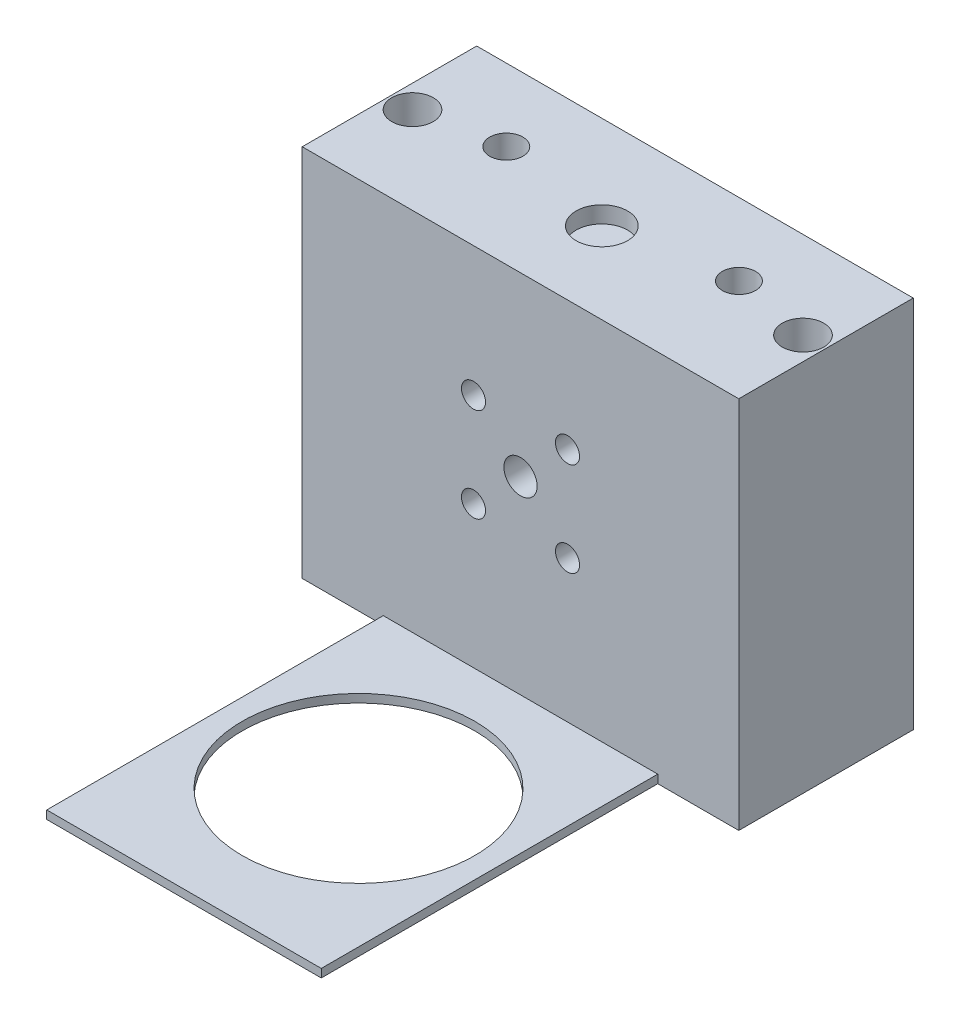
from build123d import *

# Parameters (mm, degrees)
SKETCH1_W                                            = 52.54
SKETCH1_H                                            = 21
SKETCH1_R                                            = 2.5
BOSS_EXTRUDE1_DEPTH                                  = 45
SKETCH2_R                                            = 2
CUT_EXTRUDE1_DEPTH                                   = 57.179292448
SKETCH3_R                                            = 2
CUT_EXTRUDE2_DEPTH                                   = 5
CBORE_FOR_M2_5_HEX_SOCKET_HEAD_CAP_SCREW_D           = 2.9
CBORE_FOR_M2_5_HEX_SOCKET_HEAD_CAP_SCREW_CBORE_D     = 5.5
CBORE_FOR_M2_5_HEX_SOCKET_HEAD_CAP_SCREW_CBORE_DEPTH = 16
SKETCH6_R                                            = 3.1
CUT_EXTRUDE3_DEPTH                                   = 2
SKETCH7_W                                            = 33.04
SKETCH7_H                                            = 40.5
SKETCH7_R                                            = 14
BOSS_EXTRUDE2_DEPTH                                  = 1


with BuildPart() as part:
    # Sketch1 → Boss-Extrude1 (new body)
    with BuildSketch(Plane(origin=(0, 0, 0), x_dir=(1, 0, 0), z_dir=(0, 1, 0))):
        Rectangle(SKETCH1_W, SKETCH1_H)
        with Locations(Location((23.5, 0, 0), (0, 0, 90))):
            Circle(SKETCH1_R, mode=Mode.SUBTRACT)
        with Locations(Location((-23.5, 0, 0), (0, 0, 90))):
            Circle(SKETCH1_R, mode=Mode.SUBTRACT)
    extrude(amount=BOSS_EXTRUDE1_DEPTH)

    # Sketch2 → Cut-Extrude1 (cut, through all)
    with BuildSketch(Plane(origin=(0, 0, -10.5), x_dir=(-1, 0, 0), z_dir=(0, 0, -1))):
        with Locations((0, 23.75)):
            Circle(SKETCH2_R)
    extrude(amount=-CUT_EXTRUDE1_DEPTH, mode=Mode.SUBTRACT)

    # Sketch3 → Cut-Extrude2 (cut)
    with BuildSketch(Plane(origin=(0, 45, 0), x_dir=(1, 0, 0), z_dir=(0, 1, 0))):
        with Locations(Location((-14, 1.79, 0), (0, 0, 270))):
            Circle(SKETCH3_R)
        with Locations(Location((14, 1.79, 0), (0, 0, 270))):
            Circle(SKETCH3_R)
    extrude(amount=-CUT_EXTRUDE2_DEPTH, mode=Mode.SUBTRACT)

    # CBORE for M2.5 Hex Socket Head Cap Screw1 (through all)
    with Locations(Plane(origin=(-5.656854249, 18.093145751, -10.5), x_dir=(-1, 0, 0), z_dir=(0, 0, -1))):
        with Locations((0, 0), (-11.313708498, 0), (-11.313708498, 11.313708498), (0, 11.313708498)):
            CounterBoreHole(CBORE_FOR_M2_5_HEX_SOCKET_HEAD_CAP_SCREW_D / 2, CBORE_FOR_M2_5_HEX_SOCKET_HEAD_CAP_SCREW_CBORE_D / 2, CBORE_FOR_M2_5_HEX_SOCKET_HEAD_CAP_SCREW_CBORE_DEPTH)

    # Sketch6 → Cut-Extrude3 (cut)
    with BuildSketch(Plane(origin=(0, 45, 0), x_dir=(1, 0, 0), z_dir=(0, 1, 0))):
        with Locations(Location((0, -0.71, 0), (0, 0, 270))):
            Circle(SKETCH6_R)
    extrude(amount=-CUT_EXTRUDE3_DEPTH, mode=Mode.SUBTRACT)

    # Sketch7 → Boss-Extrude2 (add)
    with BuildSketch(Plane.XZ):
        with Locations((0, 30.75)):
            Rectangle(SKETCH7_W, SKETCH7_H)
        with Locations(Location((0, 30, 0), (0, 0, 270))):
            Circle(SKETCH7_R, mode=Mode.SUBTRACT)
    extrude(amount=-BOSS_EXTRUDE2_DEPTH)


solid = part.part
